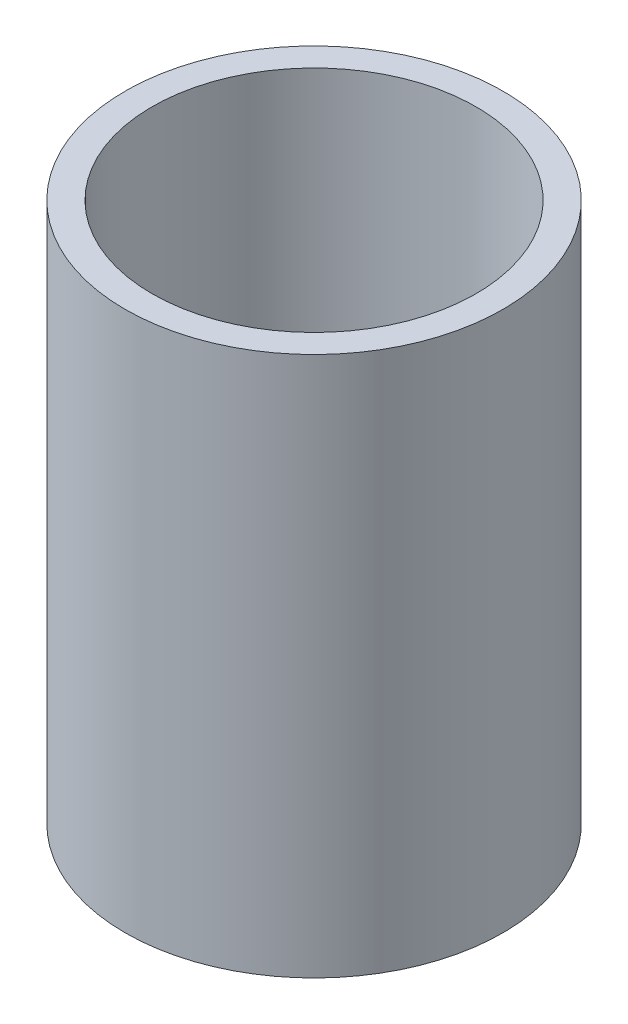
from build123d import *

# Parameters (mm, degrees)
ESQUISSE1_R             = 17.5
BOSS_EXTRU_1_DEPTH      = 50
ESQUISSE2_R             = 15
ENL_V_MAT_EXTRU_1_DEPTH = 45


with BuildPart() as part:
    # Esquisse1 → Boss.-Extru.1 (new body)
    with BuildSketch(Plane(origin=(0, 0, 0), x_dir=(1, 0, 0), z_dir=(0, 1, 0))):
        with Locations(Location((0, 0, 0), (0, 0, 270))):
            Circle(ESQUISSE1_R)
    extrude(amount=BOSS_EXTRU_1_DEPTH)

    # Esquisse2 → Enlèv. mat.-Extru.1 (cut)
    with BuildSketch(Plane(origin=(0, 50, 0), x_dir=(1, 0, 0), z_dir=(0, 1, 0))):
        with Locations(Location((0, 0, 0), (0, 0, 270))):
            Circle(ESQUISSE2_R)
    extrude(amount=-ENL_V_MAT_EXTRU_1_DEPTH, mode=Mode.SUBTRACT)


solid = part.part
